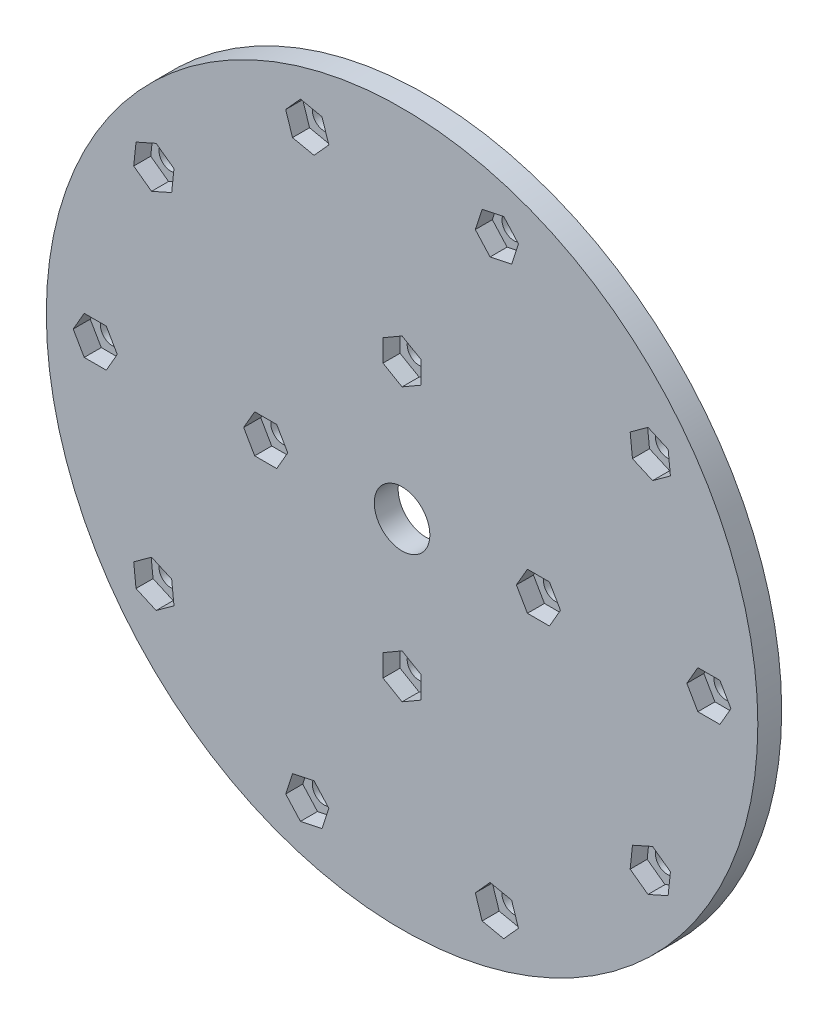
from build123d import *

# Parameters (mm, degrees)
SKETCH2_R           = 52.18
SKETCH2_R_2         = 4.075
BOSS_EXTRUDE2_DEPTH = 3.5
CUT_EXTRUDE1_DEPTH  = 2.5
SKETCH4_R           = 1.75
CUT_EXTRUDE2_DEPTH  = 146.860967066


with BuildPart() as part:
    # Sketch2 → Boss-Extrude2 (new body)
    with BuildSketch(Plane.XY):
        with Locations((-50.929581789, 50.929581789)):
            Circle(SKETCH2_R)
        with Locations((-50.929581789, 50.929581789)):
            Circle(SKETCH2_R_2, mode=Mode.SUBTRACT)
    extrude(amount=BOSS_EXTRUDE2_DEPTH)

    # Sketch3 → Cut-Extrude1 (cut)
    with BuildSketch(Plane.XY.offset(3.5)):
        Polygon((-53.729581789, 32.546162543), (-53.729581789, 29.313001036), (-50.929581789, 27.696420282), (-48.129581789, 29.313001036), (-48.129581789, 32.546162543), (-50.929581789, 34.162743297), align=None)
        Polygon((-32.546162543, 48.129581789), (-29.313001036, 48.129581789), (-27.696420282, 50.929581789), (-29.313001036, 53.729581789), (-32.546162543, 53.729581789), (-34.162743297, 50.929581789), align=None)
        Polygon((-7.546162543, 48.129581789), (-4.313001036, 48.129581789), (-2.696420282, 50.929581789), (-4.313001036, 53.729581789), (-7.546162543, 53.729581789), (-9.162743297, 50.929581789), align=None)
        Polygon((-69.313001036, 53.729581789), (-72.546162543, 53.729581789), (-74.162743297, 50.929581789), (-72.546162543, 48.129581789), (-69.313001036, 48.129581789), (-67.696420282, 50.929581789), align=None)
        Polygon((-48.129581789, 69.313001036), (-48.129581789, 72.546162543), (-50.929581789, 74.162743297), (-53.729581789, 72.546162543), (-53.729581789, 69.313001036), (-50.929581789, 67.696420282), align=None)
        Polygon((-17.477457052, 23.164200178), (-14.861774446, 21.263795526), (-11.908134437, 22.578840784), (-11.570177034, 25.794290694), (-14.185859639, 27.694695347), (-17.139499648, 26.379650089), align=None)
        Polygon((-40.186326214, 8.804250632), (-39.187224362, 5.729331312), (-36.024715191, 5.057119236), (-33.861307871, 7.45982648), (-34.860409723, 10.5347458), (-38.022918894, 11.206957876), align=None)
        Polygon((-66.998753856, 10.5347458), (-67.997855708, 7.45982648), (-65.834448388, 5.057119236), (-62.671939216, 5.729331312), (-61.672837365, 8.804250632), (-63.836244685, 11.206957876), align=None)
        Polygon((-87.67330394, 27.694695347), (-90.288986545, 25.794290694), (-89.951029141, 22.578840784), (-86.997389132, 21.263795526), (-84.381706527, 23.164200178), (-84.719663931, 26.379650089), align=None)
        Polygon((-94.313001036, 53.729581789), (-97.546162543, 53.729581789), (-99.162743297, 50.929581789), (-97.546162543, 48.129581789), (-94.313001036, 48.129581789), (-92.696420282, 50.929581789), align=None)
        Polygon((-84.381706527, 78.694963401), (-86.997389132, 80.595368053), (-89.951029141, 79.280322795), (-90.288986545, 76.064872885), (-87.67330394, 74.164468232), (-84.719663931, 75.47951349), align=None)
        Polygon((-61.672837365, 93.054912947), (-62.671939216, 96.129832267), (-65.834448388, 96.802044343), (-67.997855708, 94.399337098), (-66.998753856, 91.324417778), (-63.836244685, 90.652205703), align=None)
        Polygon((-34.860409723, 91.324417778), (-33.861307871, 94.399337098), (-36.024715191, 96.802044343), (-39.187224362, 96.129832267), (-40.186326214, 93.054912947), (-38.022918894, 90.652205703), align=None)
        Polygon((-14.185859639, 74.164468232), (-11.570177034, 76.064872885), (-11.908134437, 79.280322795), (-14.861774446, 80.595368053), (-17.477457052, 78.694963401), (-17.139499648, 75.47951349), align=None)
    extrude(amount=-CUT_EXTRUDE1_DEPTH, mode=Mode.SUBTRACT)

    # Sketch4 → Cut-Extrude2 (cut, through all)
    with BuildSketch(Plane.XY.offset(3.5)):
        with Locations((-30.929581789, 50.929581789)):
            Circle(SKETCH4_R)
        with Locations((-5.929581789, 50.929581789)):
            Circle(SKETCH4_R)
        with Locations((-50.929581789, 30.929581789)):
            Circle(SKETCH4_R)
        with Locations((-70.929581789, 50.929581789)):
            Circle(SKETCH4_R)
        with Locations((-50.929581789, 70.929581789)):
            Circle(SKETCH4_R)
        with Locations((-14.523817043, 24.479245436)):
            Circle(SKETCH4_R)
        with Locations((-37.023817043, 8.132038556)):
            Circle(SKETCH4_R)
        with Locations((-64.835346536, 8.132038556)):
            Circle(SKETCH4_R)
        with Locations((-87.335346536, 24.479245436)):
            Circle(SKETCH4_R)
        with Locations((-95.929581789, 50.929581789)):
            Circle(SKETCH4_R)
        with Locations((-87.335346536, 77.379918143)):
            Circle(SKETCH4_R)
        with Locations((-64.835346536, 93.727125023)):
            Circle(SKETCH4_R)
        with Locations((-37.023817043, 93.727125023)):
            Circle(SKETCH4_R)
        with Locations((-14.523817043, 77.379918143)):
            Circle(SKETCH4_R)
    extrude(amount=-CUT_EXTRUDE2_DEPTH, mode=Mode.SUBTRACT)


solid = part.part
